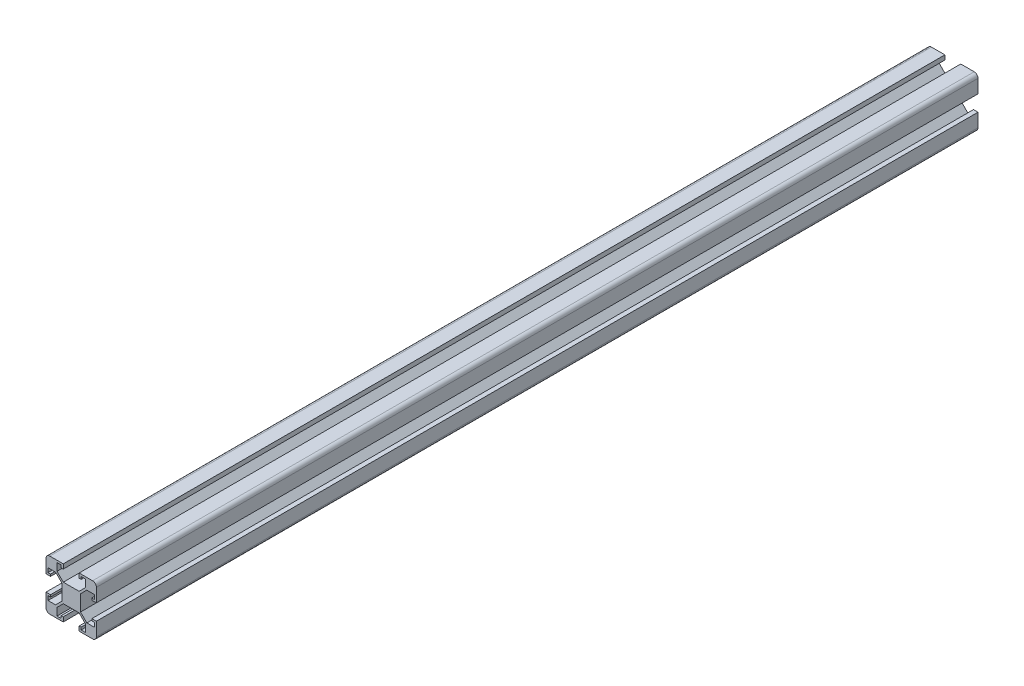
from build123d import *

# Parameters (mm, degrees)
EXTRUDE_2_DEPTH = 350
FILLET_1_R      = 1.5


with BuildPart() as part:
    # 草图1 → 凸台-拉伸2 (new body)
    with BuildSketch(Plane.XY):
        Polygon((-10, -3.15), (-10, -10), (-3.15, -10), (-3.15, -8.2), (-3.95, -8.2), (-3.95, -9.2), (-5.634314575, -9.2), (-5.634314575, -6.2), (-3.134314575, -3.7), (3.134314575, -3.7), (5.634314575, -6.2), (5.634314575, -9.2), (3.95, -9.2), (3.95, -8.2), (3.15, -8.2), (3.15, -10), (10, -10), (10, -3.15), (8.2, -3.15), (8.2, -3.95), (9.2, -3.95), (9.2, -5.634314575), (6.2, -5.634314575), (3.7, -3.134314575), (3.7, 3.134314575), (6.2, 5.634314575), (9.2, 5.634314575), (9.2, 3.95), (8.2, 3.95), (8.2, 3.15), (10, 3.15), (10, 10), (3.15, 10), (3.15, 8.2), (3.95, 8.2), (3.95, 9.2), (5.634314575, 9.2), (5.634314575, 6.2), (3.134314575, 3.7), (-3.134314575, 3.7), (-5.634314575, 6.2), (-5.634314575, 9.2), (-3.95, 9.2), (-3.95, 8.2), (-3.15, 8.2), (-3.15, 10), (-10, 10), (-10, 3.15), (-8.2, 3.15), (-8.2, 3.95), (-9.2, 3.95), (-9.2, 5.634314575), (-6.2, 5.634314575), (-3.7, 3.134314575), (-3.7, -3.134314575), (-6.2, -5.634314575), (-9.2, -5.634314575), (-9.2, -3.95), (-8.2, -3.95), (-8.2, -3.15), align=None)
    extrude(amount=EXTRUDE_2_DEPTH)

    # 圆角1
    fillet_1_edges = [part.edges().sort_by_distance(p)[0] for p in [
        (-10, -10, 175),
        (-10, 10, 175),
        (10, 10, 175),
        (10, -10, 175),
    ]]
    fillet(fillet_1_edges, radius=FILLET_1_R)


solid = part.part
